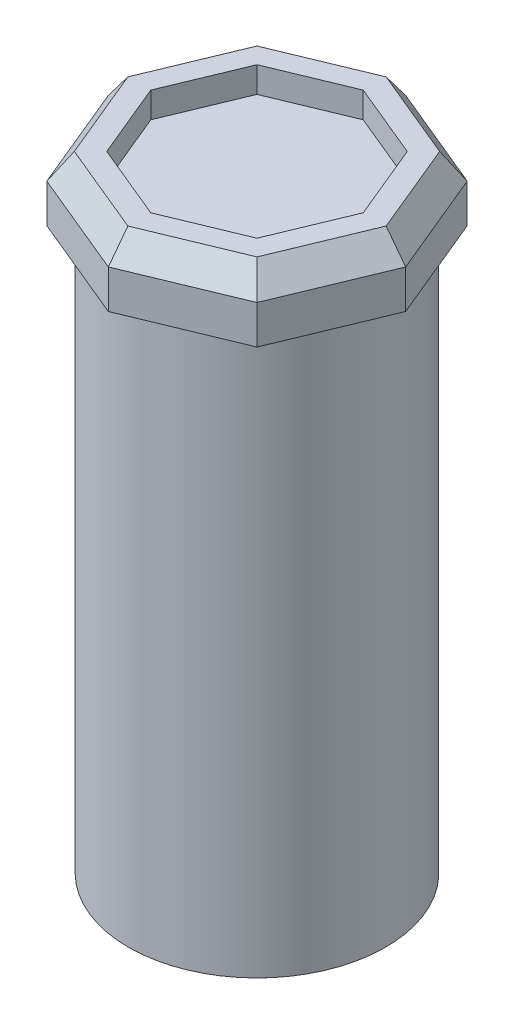
from build123d import *
from OCP.BRepFilletAPI import BRepFilletAPI_MakeChamfer

# Parameters (mm, degrees)
SKETCH1_R           = 12.7
BOSS_EXTRUDE1_DEPTH = 57.15
BOSS_EXTRUDE2_DEPTH = 6.35
CHAMFER1_SIZE       = 2.54
CHAMFER1_SIZE2      = 1.778527147
CUT_EXTRUDE1_DEPTH  = 2.54
CHAMFER2_SIZE       = 2.54
CHAMFER2_SIZE2      = 1.778527147


with BuildPart() as part:
    # Sketch1 → Boss-Extrude1 (new body)
    with BuildSketch(Plane(origin=(0, 0, 0), x_dir=(1, 0, 0), z_dir=(0, 1, 0))):
        with Locations(Location((0, 0, 0), (0, 0, 270))):
            Circle(SKETCH1_R)
    extrude(amount=BOSS_EXTRUDE1_DEPTH)

    # Sketch2 → Boss-Extrude2 (add)
    with BuildSketch(Plane(origin=(0, 57.15, 0), x_dir=(1, 0, 0), z_dir=(0, 1, 0))):
        Polygon((0, 14.681421742), (-10.381332871, 10.381332871), (-14.681421742, 0), (-10.381332871, -10.381332871), (0, -14.681421742), (10.381332871, -10.381332871), (14.681421742, 0), (10.381332871, 10.381332871), align=None)
    extrude(amount=BOSS_EXTRUDE2_DEPTH)

    # Chamfer1: one chamfer whose edges measure the first distance from different faces: ONE call of the kernel's chamfer builder (chamfer() names one face for all edges)
    chamfer1_edges_1 = [part.edges().sort_by_distance(p)[0] for p in [
        (5.190666436, 63.5, 12.531377306),
    ]]
    chamfer1_side_1 = [part.faces().sort_by_distance(p)[0] for p in [
        (5.190666436, 60.325, 12.531377306),
    ]]
    chamfer1_edges_2 = [part.edges().sort_by_distance(p)[0] for p in [
        (12.531377306, 63.5, 5.190666436),
    ]]
    chamfer1_side_2 = [part.faces().sort_by_distance(p)[0] for p in [
        (12.531377306, 60.325, 5.190666436),
    ]]
    chamfer1_edges_3 = [part.edges().sort_by_distance(p)[0] for p in [
        (12.531377306, 63.5, -5.190666436),
    ]]
    chamfer1_side_3 = [part.faces().sort_by_distance(p)[0] for p in [
        (12.531377306, 60.325, -5.190666436),
    ]]
    chamfer1_edges_4 = [part.edges().sort_by_distance(p)[0] for p in [
        (5.190666436, 63.5, -12.531377306),
    ]]
    chamfer1_side_4 = [part.faces().sort_by_distance(p)[0] for p in [
        (5.190666436, 60.325, -12.531377306),
    ]]
    chamfer1_edges_5 = [part.edges().sort_by_distance(p)[0] for p in [
        (-5.190666436, 63.5, -12.531377306),
    ]]
    chamfer1_side_5 = [part.faces().sort_by_distance(p)[0] for p in [
        (-5.190666436, 60.325, -12.531377306),
    ]]
    chamfer1_edges_6 = [part.edges().sort_by_distance(p)[0] for p in [
        (-12.531377306, 63.5, -5.190666436),
    ]]
    chamfer1_side_6 = [part.faces().sort_by_distance(p)[0] for p in [
        (-12.531377306, 60.325, -5.190666436),
    ]]
    chamfer1_edges_7 = [part.edges().sort_by_distance(p)[0] for p in [
        (-12.531377306, 63.5, 5.190666436),
    ]]
    chamfer1_side_7 = [part.faces().sort_by_distance(p)[0] for p in [
        (-12.531377306, 60.325, 5.190666436),
    ]]
    chamfer1_edges_8 = [part.edges().sort_by_distance(p)[0] for p in [
        (-5.190666436, 63.5, 12.531377306),
    ]]
    chamfer1_side_8 = [part.faces().sort_by_distance(p)[0] for p in [
        (-5.190666436, 60.325, 12.531377306),
    ]]
    chamfer1 = BRepFilletAPI_MakeChamfer(part.part.solid().wrapped)
    for e in chamfer1_edges_1:
        chamfer1.Add(CHAMFER1_SIZE, CHAMFER1_SIZE2, e.wrapped, chamfer1_side_1[0].wrapped)  # the first distance lies on this face
    for e in chamfer1_edges_2:
        chamfer1.Add(CHAMFER1_SIZE, CHAMFER1_SIZE2, e.wrapped, chamfer1_side_2[0].wrapped)  # the first distance lies on this face
    for e in chamfer1_edges_3:
        chamfer1.Add(CHAMFER1_SIZE, CHAMFER1_SIZE2, e.wrapped, chamfer1_side_3[0].wrapped)  # the first distance lies on this face
    for e in chamfer1_edges_4:
        chamfer1.Add(CHAMFER1_SIZE, CHAMFER1_SIZE2, e.wrapped, chamfer1_side_4[0].wrapped)  # the first distance lies on this face
    for e in chamfer1_edges_5:
        chamfer1.Add(CHAMFER1_SIZE, CHAMFER1_SIZE2, e.wrapped, chamfer1_side_5[0].wrapped)  # the first distance lies on this face
    for e in chamfer1_edges_6:
        chamfer1.Add(CHAMFER1_SIZE, CHAMFER1_SIZE2, e.wrapped, chamfer1_side_6[0].wrapped)  # the first distance lies on this face
    for e in chamfer1_edges_7:
        chamfer1.Add(CHAMFER1_SIZE, CHAMFER1_SIZE2, e.wrapped, chamfer1_side_7[0].wrapped)  # the first distance lies on this face
    for e in chamfer1_edges_8:
        chamfer1.Add(CHAMFER1_SIZE, CHAMFER1_SIZE2, e.wrapped, chamfer1_side_8[0].wrapped)  # the first distance lies on this face
    add(Compound.cast(chamfer1.Shape()), mode=Mode.REPLACE)

    # Sketch3 → Cut-Extrude1 (cut)
    with BuildSketch(Plane(origin=(0, 63.5, 0), x_dir=(1, 0, 0), z_dir=(0, 1, 0))):
        Polygon((0, 10.493107574), (-7.419747521, 7.419747521), (-10.493107574, 0), (-7.419747521, -7.419747521), (0, -10.493107574), (7.419747521, -7.419747521), (10.493107574, 0), (7.419747521, 7.419747521), align=None)
    extrude(amount=-CUT_EXTRUDE1_DEPTH, mode=Mode.SUBTRACT)

    # Chamfer2
    chamfer2_edges = [part.edges().sort_by_distance(p)[0] for p in [
        (0, 0, -12.7),
    ]]
    chamfer2_side = [part.faces().sort_by_distance(p)[0] for p in [
        (0, 0, 0),
    ]]
    chamfer(chamfer2_edges, length=CHAMFER2_SIZE, length2=CHAMFER2_SIZE2, reference=chamfer2_side[0])


solid = part.part
